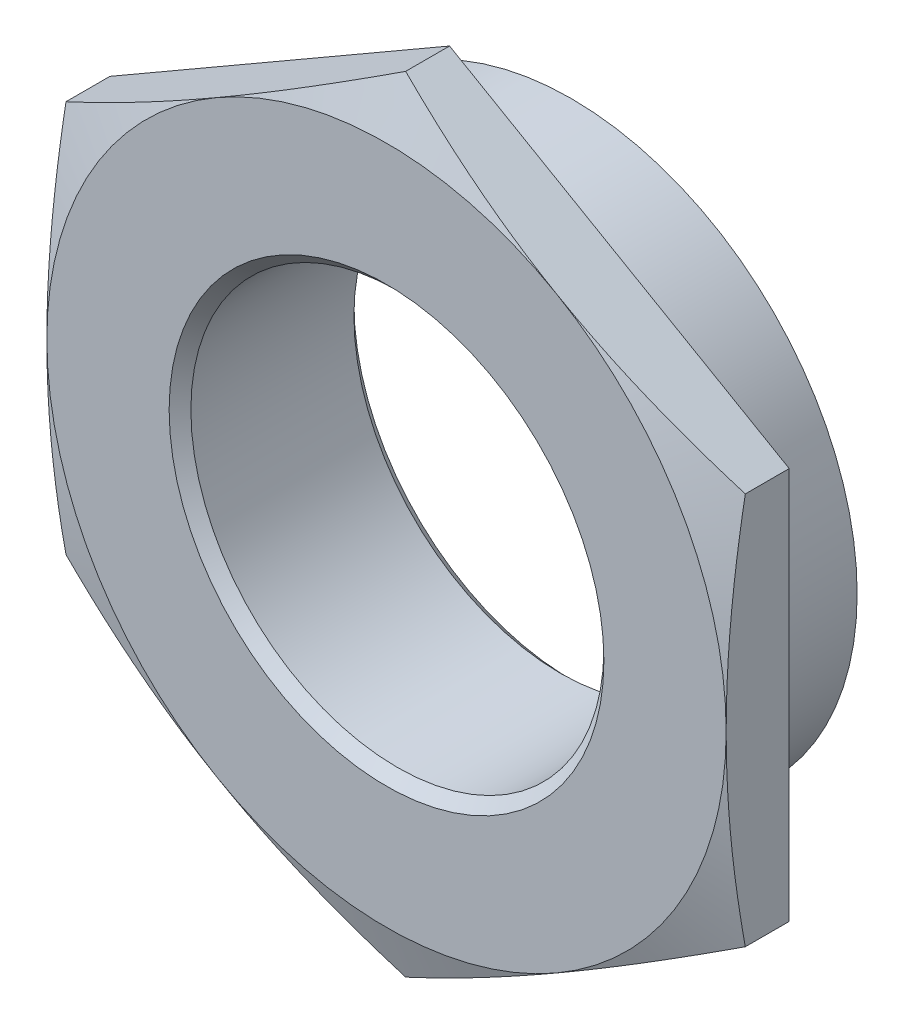
from build123d import *

# Parameters (mm, degrees)
EXTRUDE1_DEPTH      = 2.159
SKETCH14_OUTSIDE_W  = 12.402
SKETCH14_OUTSIDE_H  = 13.63
SKETCH14_OUTSIDE_R  = 3.3401
CUT_EXTRUDE7_DEPTH  = 1.4224
SKETCH7_R           = 2.413
CUT_EXTRUDE3_DEPTH  = 7.435336794
SKETCH20_OUTSIDE_W  = 53.258
SKETCH20_OUTSIDE_H  = 54.486
SKETCH20_OUTSIDE_R  = 3.96875
CUT_EXTRUDE13_DEPTH = 7.435336794
CUT_EXTRUDE13_DRAFT = -70


with BuildPart() as part:
    # Sketch1 → Extrude1 (new body)
    with BuildSketch(Plane.XY):
        Polygon((0, 4.582717762), (-3.96875, 2.291358881), (-3.96875, -2.291358881), (0, -4.582717762), (3.96875, -2.291358881), (3.96875, 2.291358881), align=None)
    extrude(amount=-EXTRUDE1_DEPTH)

    # Sketch14 outside → Cut-Extrude7 (cut)
    with BuildSketch(Plane(origin=(0, 0, -2.159), x_dir=(-1, 0, 0), z_dir=(0, 0, -1))):
        Rectangle(SKETCH14_OUTSIDE_W, SKETCH14_OUTSIDE_H)
        Circle(SKETCH14_OUTSIDE_R, mode=Mode.SUBTRACT)
    extrude(amount=-CUT_EXTRUDE7_DEPTH, mode=Mode.SUBTRACT)

    # Sketch7 → Cut-Extrude3 (cut, through all)
    with BuildSketch(Plane.XY):
        Circle(SKETCH7_R)
    extrude(amount=-CUT_EXTRUDE3_DEPTH, mode=Mode.SUBTRACT)

    # Cut-Extrude6 cone 1 section (through the dimple's axis) → Cut-Extrude6 (revolve, cut)
    with BuildSketch(Plane(origin=(0, 0, 0), x_dir=(0, -1, 0), z_dir=(1, 0, 0))):
        Polygon((0, 0), (2.54, 0), (0, 2.54), align=None)
    revolve(axis=Axis((0, 0, 0), (0, 0, -1)), mode=Mode.SUBTRACT)

    # Cut-Extrude11 cone 1 section (through the dimple's axis) → Cut-Extrude11 (revolve, cut)
    with BuildSketch(Plane(origin=(0, 0, -2.159), x_dir=(0, 1, 0), z_dir=(1, 0, 0))):
        Polygon((0, 0), (2.54, 0), (0, 2.54), align=None)
    revolve(axis=Axis((0, 0, -2.159), (0, 0, 1)), mode=Mode.SUBTRACT)


with BuildPart() as cut_extrude13_tool:
    # Sketch20 outside → Cut-Extrude13 (with draft: the straight prism first)
    with BuildSketch(Plane.XY):
        Rectangle(SKETCH20_OUTSIDE_W, SKETCH20_OUTSIDE_H)
        Circle(SKETCH20_OUTSIDE_R, mode=Mode.SUBTRACT)
    extrude(amount=-CUT_EXTRUDE13_DEPTH)
    # Cut-Extrude13: the draft: its side faces are tilted about the plane it starts from
    cut_extrude13_sides = [cut_extrude13_tool.faces().sort_by_distance(p)[0] for p in [
        (0, -27.243, -3.717668397),
        (26.629, 0, -3.717668397),
        (0, 27.243, -3.717668397),
        (-26.629, 0, -3.717668397),
        (-3.96875, 0, -3.717668397),
    ]]
    draft(cut_extrude13_sides, Plane.XY, CUT_EXTRUDE13_DRAFT)


with BuildPart() as part_1:
    add(part.part)

    # Cut-Extrude13: cut by cut_extrude13_tool
    add(cut_extrude13_tool.part, mode=Mode.SUBTRACT)


solid = part_1.part
